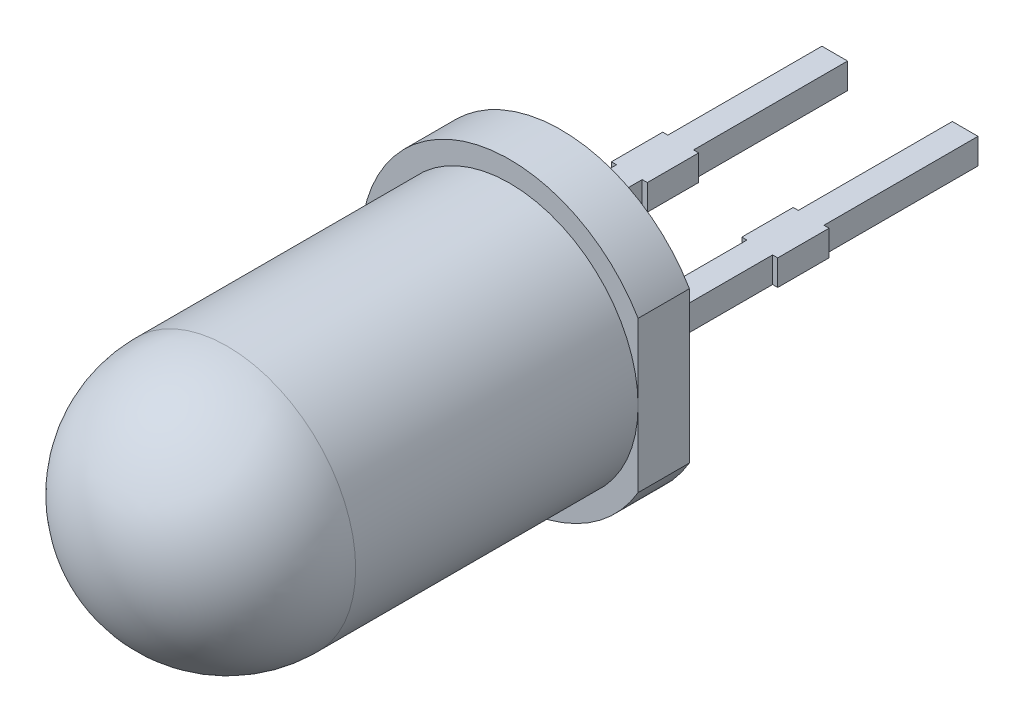
from build123d import *

# Parameters (mm, degrees)
EXTRUDE_1_DEPTH     = 0.25
EXTRUDE_1_2_DEPTH   = 0.25
CUT_EXTRUDE_START   = -1
CUT_EXTRUDE_1_DEPTH = 1


with BuildPart() as part:
    # Эскиз1 → Бобышка-Вытянуть1 (new, symmetric)
    with BuildSketch(Plane.XZ):
        Polygon((-1.52, 3.6), (-1.52, 1), (-1.62, 1), (-1.62, 0), (-1.52, 0), (-1.52, -3), (-1.02, -3), (-1.02, 0), (-0.92, 0), (-0.92, 1), (-1.02, 1), (-1.02, 3.6), align=None)
    extrude(amount=EXTRUDE_1_DEPTH, both=True)



with BuildPart() as body_2:
    # Эскиз1 → Extrude 1 2 (new, symmetric)
    with BuildSketch(Plane.XZ):
        Polygon((1.02, 3.6), (1.02, 1), (0.92, 1), (0.92, 0), (1.02, 0), (1.02, -3), (1.52, -3), (1.52, 0), (1.62, 0), (1.62, 1), (1.52, 1), (1.52, 3.6), align=None)
    extrude(amount=EXTRUDE_1_2_DEPTH, both=True)


with BuildPart() as part_1:
    add(part.part)

    add(body_2.part)  # Повернуть1 merges body 2
    # Эскиз2 → Повернуть1 (revolve)
    with BuildSketch(Plane(origin=(0, 0, 0), x_dir=(1, 0, 0), z_dir=(0, 1, 0))):
        with BuildLine():
            Line((0, -3.6), (0, -12.6))
            ThreePointArc((0, -12.6), (1.767766953, -11.867766953), (2.5, -10.1))
            Line((2.5, -10.1), (2.5, -4.6))
            Line((2.5, -4.6), (2.9, -4.6))
            Line((2.9, -4.6), (2.9, -3.6))
            Line((2.9, -3.6), (0, -3.6))
        make_face()
    revolve(axis=Axis((0, 0, 3.6), (0, 0, -1)))

    # Эскиз3 → Вырез-Вытянуть1 (cut)
    with BuildSketch(Plane.XY.offset(4.6).offset(CUT_EXTRUDE_START)):
        with BuildLine():
            Line((2.5, 1.469693846), (2.5, -1.469693846))
            ThreePointArc((2.5, -1.469693846), (2.9, 0), (2.5, 1.469693846))
        make_face()
    extrude(amount=CUT_EXTRUDE_1_DEPTH, mode=Mode.SUBTRACT)


solid = part_1.part
